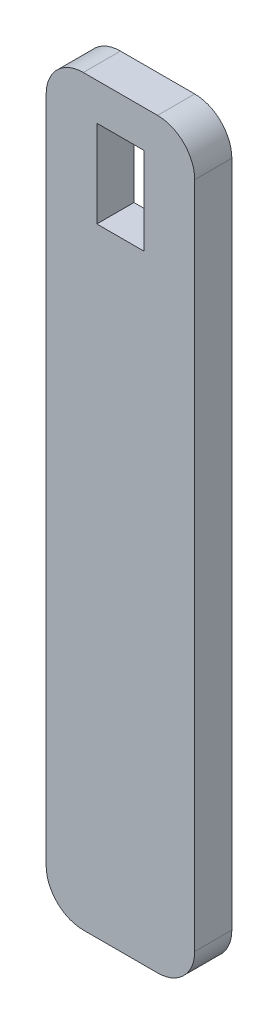
from build123d import *

# Parameters (mm, degrees)
SKICA1_W                 = 40
SKICA1_H                 = 200
P_IDAT_VYSUNUT_M1_DEPTH  = 10
ZAOBLIT1_R               = 10
SKICA2_W                 = 12.7
SKICA2_H                 = 23.5
ODEBRAT_VYSUNUT_M1_DEPTH = 205.205778567


with BuildPart() as part:
    # Skica1 → Přidat vysunutím1 (new body)
    with BuildSketch(Plane.XY):
        with Locations((20, 100)):
            Rectangle(SKICA1_W, SKICA1_H)
    extrude(amount=P_IDAT_VYSUNUT_M1_DEPTH)

    # Zaoblit1
    zaoblit1_edges = [part.edges().sort_by_distance(p)[0] for p in [
        (0, 200, 5),
        (40, 200, 5),
        (40, 0, 5),
        (0, 0, 5),
    ]]
    fillet(zaoblit1_edges, radius=ZAOBLIT1_R)

    # Skica2 → Odebrat vysunutím1 (cut, through all)
    with BuildSketch(Plane.XY.offset(10)):
        with Locations((20, 178.25)):
            Rectangle(SKICA2_W, SKICA2_H)
    extrude(amount=-ODEBRAT_VYSUNUT_M1_DEPTH, mode=Mode.SUBTRACT)


solid = part.part
